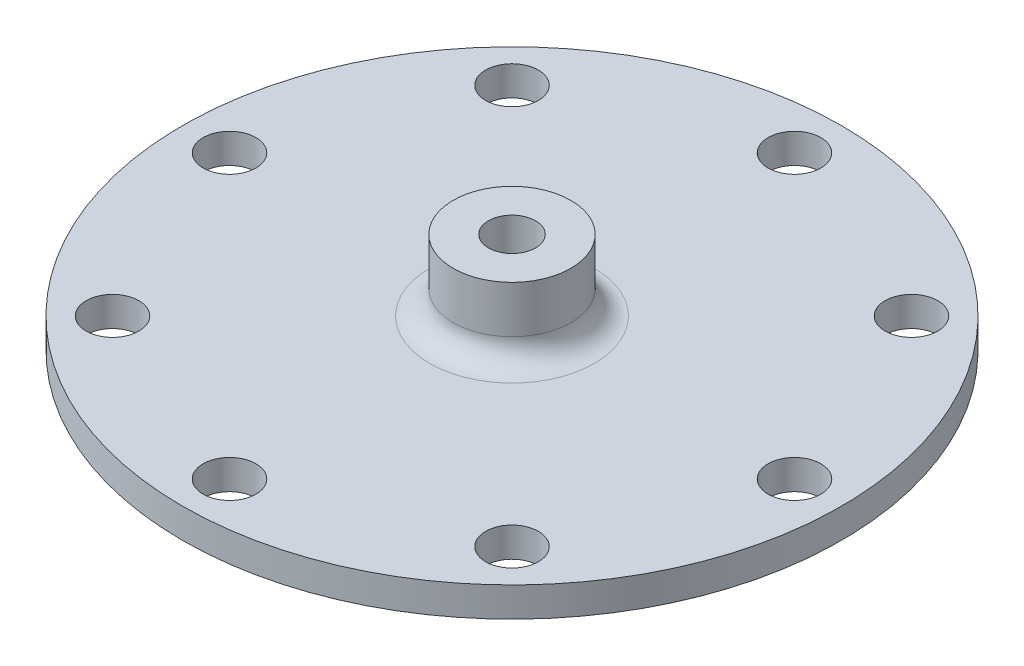
from build123d import *

# Parameters (mm, degrees)
SKETCH1_R           = 22.225
BOSS_EXTRUDE1_DEPTH = 2
SKETCH2_R           = 1.778
CUT_EXTRUDE1_DEPTH  = 32.494463799
SKETCH3_R           = 3.96875
BOSS_EXTRUDE2_DEPTH = 4.7625
SKETCH4_R           = 1.5875
CUT_EXTRUDE2_DEPTH  = 4.7625
FILLET1_R           = 1.5875
SKETCH5_R           = 0.79375
CUT_EXTRUDE6_DEPTH  = 2.54


with BuildPart() as part:
    # Sketch1 → Boss-Extrude1 (new body)
    with BuildSketch(Plane(origin=(0, 0, 0), x_dir=(1, 0, 0), z_dir=(0, 1, 0))):
        with Locations(Location((0, 0, 0), (0, 0, 270))):
            Circle(SKETCH1_R)
    extrude(amount=BOSS_EXTRUDE1_DEPTH)

    # Sketch2 → Cut-Extrude1 (cut, through all)
    with BuildSketch(Plane(origin=(0, 2, 0), x_dir=(1, 0, 0), z_dir=(0, 1, 0))):
        with Locations(Location((0, 19.05, 0), (0, 0, 270))):
            Circle(SKETCH2_R)
        with Locations(Location((13.470384182, 13.470384182, 0), (0, 0, 270))):
            Circle(SKETCH2_R)
        with Locations(Location((19.05, 0, 0), (0, 0, 270))):
            Circle(SKETCH2_R)
        with Locations(Location((13.470384182, -13.470384182, 0), (0, 0, 270))):
            Circle(SKETCH2_R)
        with Locations(Location((0, -19.05, 0), (0, 0, 270))):
            Circle(SKETCH2_R)
        with Locations(Location((-13.470384182, -13.470384182, 0), (0, 0, 270))):
            Circle(SKETCH2_R)
        with Locations(Location((-19.05, 0, 0), (0, 0, 270))):
            Circle(SKETCH2_R)
        with Locations(Location((-13.470384182, 13.470384182, 0), (0, 0, 270))):
            Circle(SKETCH2_R)
    extrude(amount=-CUT_EXTRUDE1_DEPTH, mode=Mode.SUBTRACT)

    # Sketch3 → Boss-Extrude2 (add)
    with BuildSketch(Plane(origin=(0, 2, 0), x_dir=(1, 0, 0), z_dir=(0, 1, 0))):
        with Locations(Location((0, 0, 0), (0, 0, 90))):
            Circle(SKETCH3_R)
    extrude(amount=BOSS_EXTRUDE2_DEPTH)

    # Sketch4 → Cut-Extrude2 (cut)
    with BuildSketch(Plane(origin=(0, 6.7625, 0), x_dir=(1, 0, 0), z_dir=(0, 1, 0))):
        with Locations(Location((0, 0, 0), (0, 0, 270))):
            Circle(SKETCH4_R)
    extrude(amount=-CUT_EXTRUDE2_DEPTH, mode=Mode.SUBTRACT)

    # Fillet1
    fillet1_edges = [part.edges().sort_by_distance(p)[0] for p in [
        (0, 2, 3.96875),
    ]]
    fillet(fillet1_edges, radius=FILLET1_R)

    # Sketch5 → Cut-Extrude6 (cut)
    with BuildSketch(Plane(origin=(0, 0, 0), x_dir=(-1, 0, 0), z_dir=(0, -1, 0))):
        with Locations(Location((0, 0, 0), (0, 0, 90))):
            Circle(SKETCH5_R)
    extrude(amount=-CUT_EXTRUDE6_DEPTH, mode=Mode.SUBTRACT)


solid = part.part
